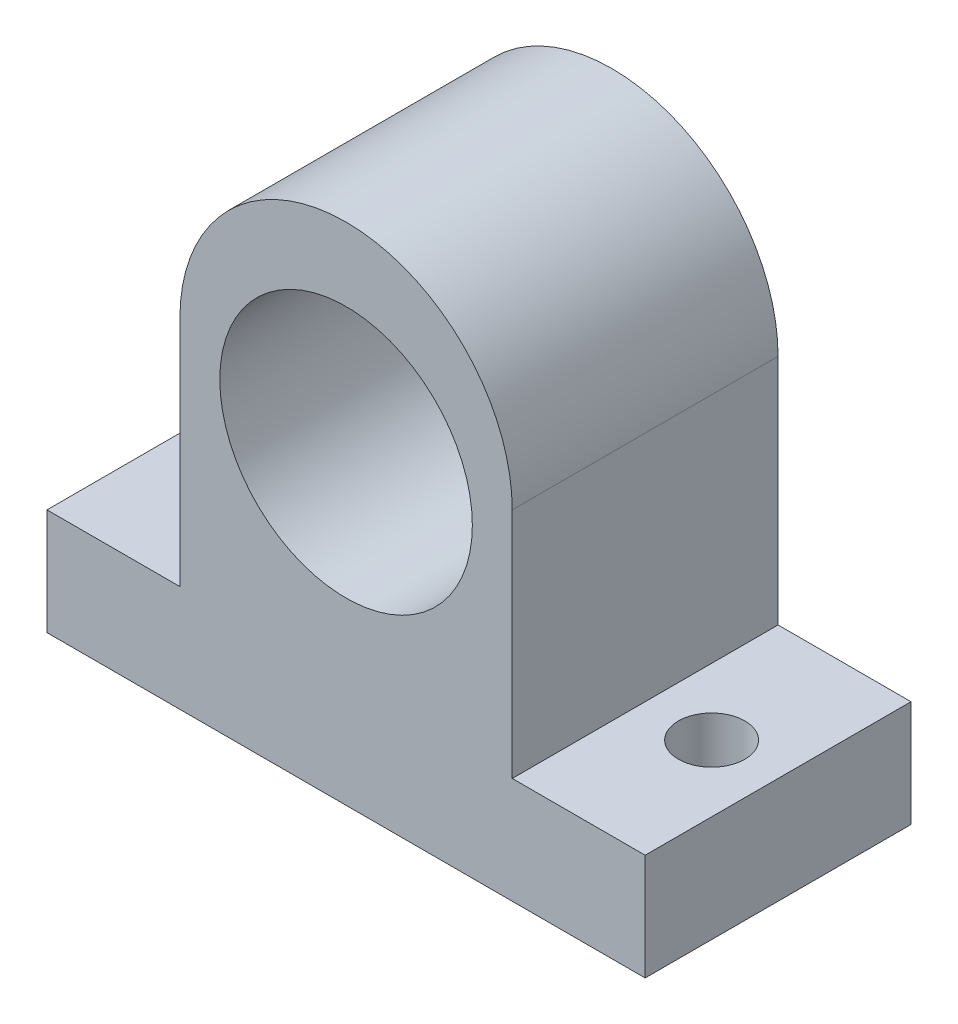
from build123d import *

# Parameters (mm, degrees)
SKETCH2_W           = 45
SKETCH2_H           = 20
BOSS_EXTRUDE1_DEPTH = 8
SKETCH3_W           = 25
SKETCH3_H           = 20
BOSS_EXTRUDE2_DEPTH = 30
SKETCH4_R           = 2.5
CUT_EXTRUDE1_DEPTH  = 8
SKETCH5_R           = 9.5
CUT_EXTRUDE2_DEPTH  = 20
FILLET2_RADIUS      = 12.5
FILLET2_LENGTH      = 20


with BuildPart() as part:
    # Sketch2 → Boss-Extrude1 (new body)
    with BuildSketch(Plane(origin=(0, 0, 0), x_dir=(1, 0, 0), z_dir=(0, 1, 0))):
        Rectangle(SKETCH2_W, SKETCH2_H)
    extrude(amount=BOSS_EXTRUDE1_DEPTH)

    # Sketch3 → Boss-Extrude2 (add)
    with BuildSketch(Plane(origin=(0, 8, 0), x_dir=(1, 0, 0), z_dir=(0, 1, 0))):
        Rectangle(SKETCH3_W, SKETCH3_H)
    extrude(amount=BOSS_EXTRUDE2_DEPTH)

    # Sketch4 → Cut-Extrude1 (cut)
    with BuildSketch(Plane(origin=(0, 8, 0), x_dir=(1, 0, 0), z_dir=(0, 1, 0))):
        with Locations(Location((-17.5, 0, 0), (0, 0, 270))):
            Circle(SKETCH4_R)
        with Locations(Location((17.5, 0, 0), (0, 0, 270))):
            Circle(SKETCH4_R)
    extrude(amount=-CUT_EXTRUDE1_DEPTH, mode=Mode.SUBTRACT)

    # Sketch5 → Cut-Extrude2 (cut)
    with BuildSketch(Plane.XY.offset(10)):
        with Locations((0, 23)):
            Circle(SKETCH5_R)
    extrude(amount=-CUT_EXTRUDE2_DEPTH, mode=Mode.SUBTRACT)

    # Fillet2: full round fillet: the end face becomes a half cylinder, R = half its width
    fillet2_face = Plane((0, 38, 0), x_dir=(0, 0, -1), z_dir=(0, 1, 0))  # on the end face: x along it, z out of the body
    fillet2_slab = fillet2_face.offset(-FILLET2_RADIUS / 2) * Box(FILLET2_LENGTH, 2 * FILLET2_RADIUS, FILLET2_RADIUS, mode=Mode.PRIVATE)  # the body's end, R deep
    fillet2_round = Plane((0, 25.5, 0), x_dir=(0, 1, 0), z_dir=(0, 0, -1)) * Cylinder(FILLET2_RADIUS, FILLET2_LENGTH, mode=Mode.PRIVATE)  # its axis R under the face
    add(fillet2_slab - fillet2_round, mode=Mode.SUBTRACT)


solid = part.part
